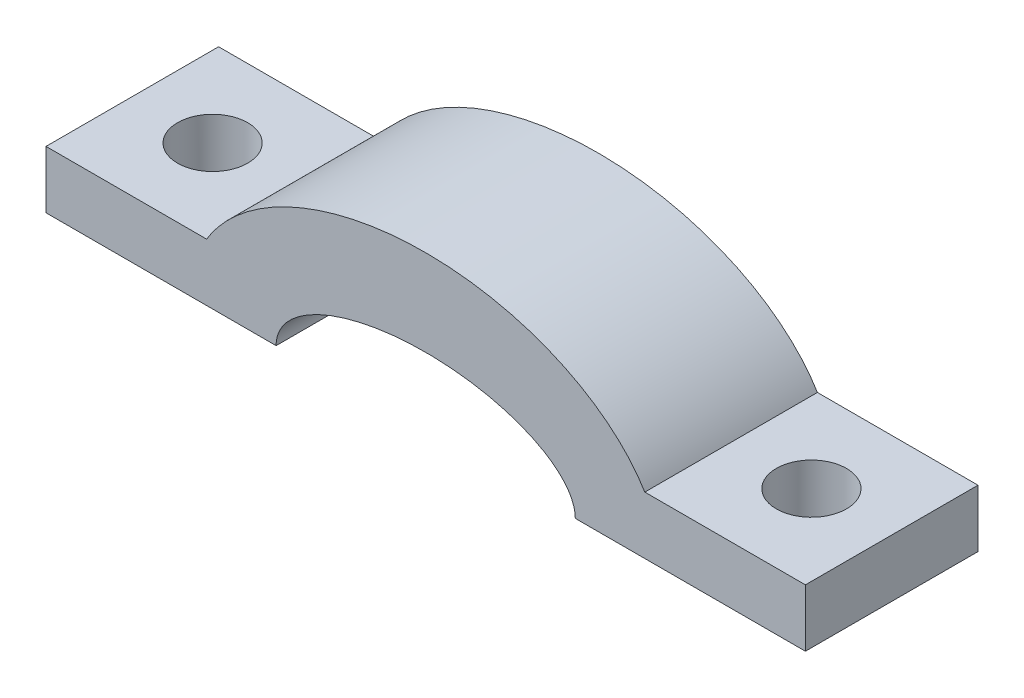
from build123d import *

# Parameters (mm, degrees)
BOSS_EXTRUDE1_DEPTH = 15
SKETCH3_W           = 20
SKETCH3_H           = 15
BOSS_EXTRUDE2_DEPTH = 5
SKETCH5_R           = 3.05
CUT_EXTRUDE2_DEPTH  = 10


with BuildPart() as part:
    # Sketch2 → Boss-Extrude1 (new body)
    with BuildSketch(Plane.XY):
        with BuildLine():
            add(Edge.make_bspline(
                [(13, 0), (13, 6), (0, 6), (-13, 6), (-13, 0)],
                knots=[0, 0, 0, 1.570796327, 1.570796327, 3.141592654, 3.141592654, 3.141592654], degree=2, weights=[1, 0.707106781, 1, 0.707106781, 1]))
            Line((13, 0), (20.5, 0))
            add(Edge.make_bspline(
                [(20.5, 0), (20.5, 13.5), (0, 13.5), (-20.5, 13.5), (-20.5, 0)],
                knots=[0, 0, 0, 1.570796327, 1.570796327, 3.141592654, 3.141592654, 3.141592654], degree=2, weights=[1, 0.707106781, 1, 0.707106781, 1]))
            Line((-20.5, 0), (-13, 0))
        make_face()
    extrude(amount=BOSS_EXTRUDE1_DEPTH)

    # Sketch3 → Boss-Extrude2 (add)
    with BuildSketch(Plane.XZ):
        with Locations((23, 7.5)):
            Rectangle(SKETCH3_W, SKETCH3_H)
        with Locations((-23, 7.5)):
            Rectangle(SKETCH3_W, SKETCH3_H)
    extrude(amount=-BOSS_EXTRUDE2_DEPTH)

    # Sketch5 → Cut-Extrude2 (cut)
    with BuildSketch(Plane(origin=(0, 5, 0), x_dir=(1, 0, 0), z_dir=(0, 1, 0))):
        with Locations(Location((26.021062673, -7.5, 0), (0, 0, 270))):
            Circle(SKETCH5_R)
        with Locations(Location((-26.021062673, -7.5, 0), (0, 0, 270))):
            Circle(SKETCH5_R)
    extrude(amount=-CUT_EXTRUDE2_DEPTH, mode=Mode.SUBTRACT)


solid = part.part
